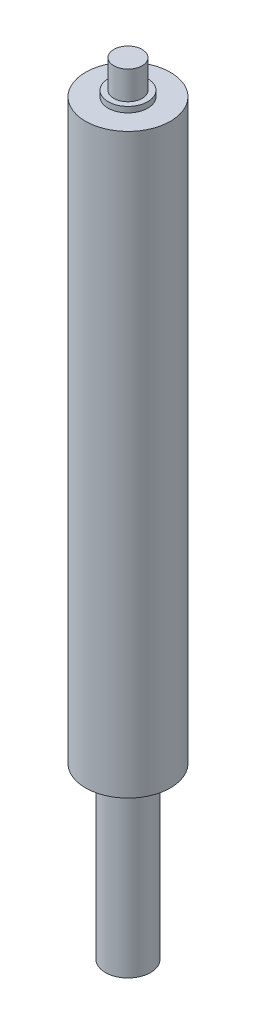
from build123d import *

# Parameters (mm, degrees)
SKETCH1_R           = 7.5
BOSS_EXTRUDE1_DEPTH = 102
SKETCH2_R           = 5
BOSS_EXTRUDE2_DEPTH = 1
SKETCH3_R           = 4
BOSS_EXTRUDE3_DEPTH = 29
SKETCH4_R           = 3.5
BOSS_EXTRUDE4_DEPTH = 1
SKETCH5_R           = 2.5
BOSS_EXTRUDE5_DEPTH = 5


with BuildPart() as part:
    # Sketch1 → Boss-Extrude1 (new body)
    with BuildSketch(Plane(origin=(0, 0, 0), x_dir=(1, 0, 0), z_dir=(0, 1, 0))):
        with Locations(Location((0, 0, 0), (0, 0, 270))):
            Circle(SKETCH1_R)
    extrude(amount=BOSS_EXTRUDE1_DEPTH)

    # Sketch2 → Boss-Extrude2 (add)
    with BuildSketch(Plane.XZ):
        with Locations(Location((0, 0, 0), (0, 0, 270))):
            Circle(SKETCH2_R)
    extrude(amount=BOSS_EXTRUDE2_DEPTH)

    # Sketch3 → Boss-Extrude3 (add)
    with BuildSketch(Plane.XZ.offset(1)):
        with Locations(Location((0, 0, 0), (0, 0, 90))):
            Circle(SKETCH3_R)
    extrude(amount=BOSS_EXTRUDE3_DEPTH)

    # Sketch4 → Boss-Extrude4 (add)
    with BuildSketch(Plane(origin=(0, 102, 0), x_dir=(1, 0, 0), z_dir=(0, 1, 0))):
        with Locations(Location((0, 0, 0), (0, 0, 270))):
            Circle(SKETCH4_R)
    extrude(amount=BOSS_EXTRUDE4_DEPTH)

    # Sketch5 → Boss-Extrude5 (add)
    with BuildSketch(Plane(origin=(0, 103, 0), x_dir=(1, 0, 0), z_dir=(0, 1, 0))):
        with Locations(Location((0, 0, 0), (0, 0, 270))):
            Circle(SKETCH5_R)
    extrude(amount=BOSS_EXTRUDE5_DEPTH)


solid = part.part
